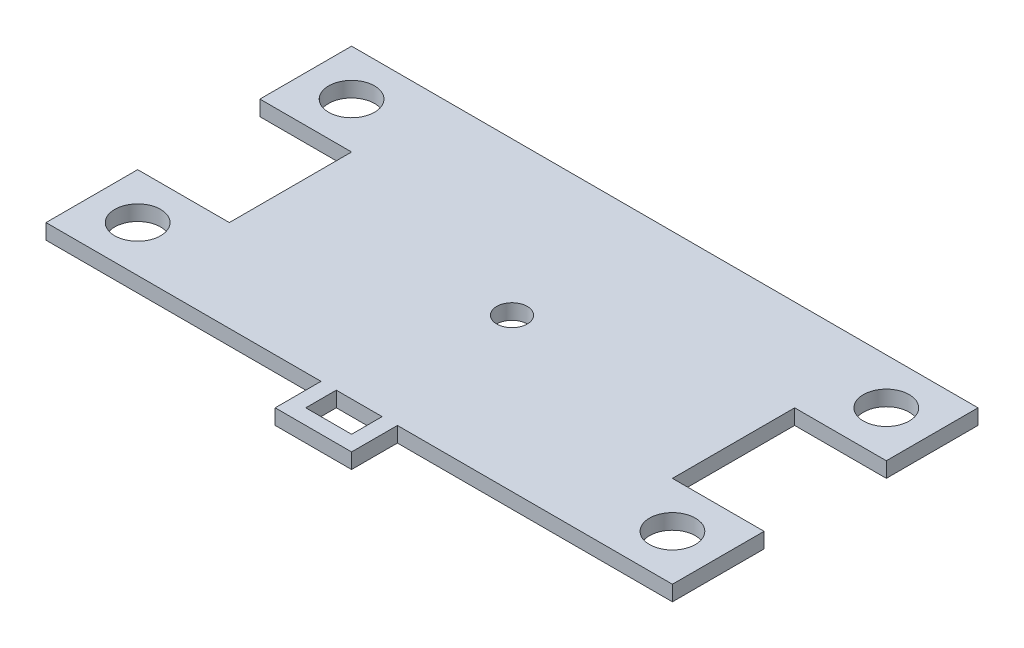
from build123d import *

# Parameters (mm, degrees)
CROQUIS2_R              = 1.5
CROQUIS2_R_2            = 1
CROQUIS2_W              = 3
CROQUIS2_H              = 2
SALIENTE_EXTRUIR1_DEPTH = 1


with BuildPart() as part:
    # Croquis2 → Saliente-Extruir1 (new body)
    with BuildSketch(Plane(origin=(0, 0, 0), x_dir=(1, 0, 0), z_dir=(0, 1, 0))):
        Polygon((38, 17), (-3, 17), (-3, 11), (3, 11), (3, 3), (-3, 3), (-3, -3), (15, -3), (15, -6), (20, -6), (20, -3), (38, -3), (38, 3), (32, 3), (32, 11), (38, 11), align=None)
        with Locations(Location((0, 14, 0), (0, 0, 270))):
            Circle(CROQUIS2_R, mode=Mode.SUBTRACT)
        with Locations(Location((0, 0, 0), (0, 0, 270))):
            Circle(CROQUIS2_R, mode=Mode.SUBTRACT)
        with Locations(Location((35, 0, 0), (0, 0, 270))):
            Circle(CROQUIS2_R, mode=Mode.SUBTRACT)
        with Locations(Location((35, 14, 0), (0, 0, 270))):
            Circle(CROQUIS2_R, mode=Mode.SUBTRACT)
        with Locations(Location((17.5, 7, 0), (0, 0, 270))):
            Circle(CROQUIS2_R_2, mode=Mode.SUBTRACT)
        with Locations((17.5, -4)):
            Rectangle(CROQUIS2_W, CROQUIS2_H, mode=Mode.SUBTRACT)
    extrude(amount=SALIENTE_EXTRUIR1_DEPTH)


solid = part.part
